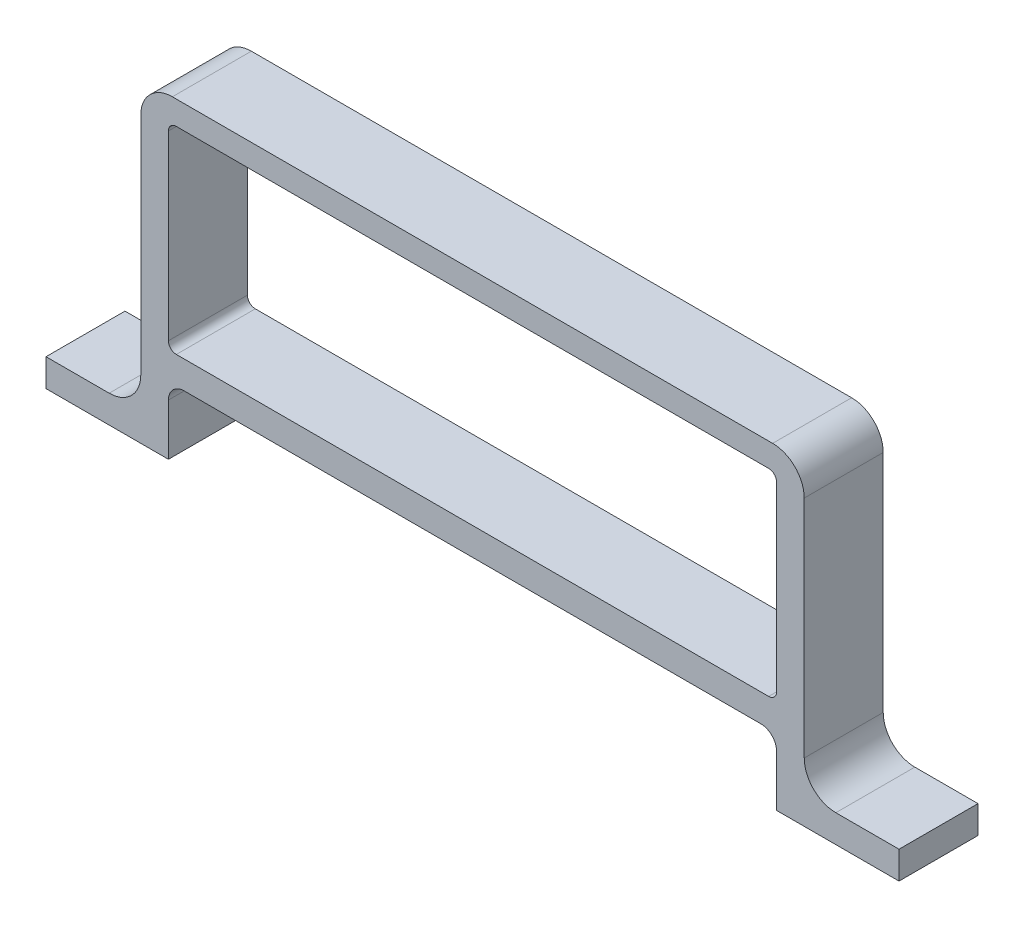
from build123d import *

# Parameters (mm, degrees)
SALIENTE_EXTRUIR2_DEPTH = 10


with BuildPart() as part:
    # Croquis1 → Saliente-Extruir2 (new body)
    with BuildSketch(Plane.XY):
        with BuildLine():
            ThreePointArc((-38.687161159, 0.254415054), (-39.39426794, 0.547308273), (-39.687161159, 1.254415054))
            Line((-39.687161159, 1.254415054), (-39.687161159, 24.254415054))
            ThreePointArc((-39.687161159, 24.254415054), (-39.39426794, 24.961521836), (-38.687161159, 25.254415054))
            Line((-38.687161159, 25.254415054), (-1.187161159, 25.254415054))
            Line((-1.187161159, 25.254415054), (-1.187161159, 28.254415054))
            Line((-1.187161159, 28.254415054), (-39.187161159, 28.254415054))
            ThreePointArc((-39.187161159, 28.254415054), (-42.015588284, 27.082842179), (-43.187161159, 24.254415054))
            Line((-43.187161159, 24.254415054), (-43.187161159, -3.245584946))
            Line((-43.187161159, -3.245584946), (-43.187161159, -4.245584946))
            ThreePointArc((-43.187161159, -4.245584946), (-44.358734034, -7.07401207), (-47.187161159, -8.245584946))
            Line((-47.187161159, -8.245584946), (-55.187161159, -8.245584946))
            Line((-55.187161159, -8.245584946), (-55.187161159, -11.745584946))
            Line((-55.187161159, -11.745584946), (-43.187161159, -11.745584946))
            Line((-43.187161159, -11.745584946), (-39.687161159, -11.745584946))
            Line((-39.687161159, -11.745584946), (-39.687161159, -5.245584946))
            ThreePointArc((-39.687161159, -5.245584946), (-39.101374721, -3.831371383), (-37.687161159, -3.245584946))
            Line((-37.687161159, -3.245584946), (-1.187161159, -3.245584946))
            Line((-1.187161159, -3.245584946), (-1.187161159, 0.254415054))
            Line((-1.187161159, 0.254415054), (-38.687161159, 0.254415054))
        make_face()
    saliente_extruir2 = extrude(amount=SALIENTE_EXTRUIR2_DEPTH)

    # Simetría2: Saliente-Extruir2 across plane
    add(saliente_extruir2.mirror(Plane(origin=(-1.187161159, 0, 10), x_dir=(0, 0, 1), z_dir=(-1, 0, 0))))


solid = part.part
